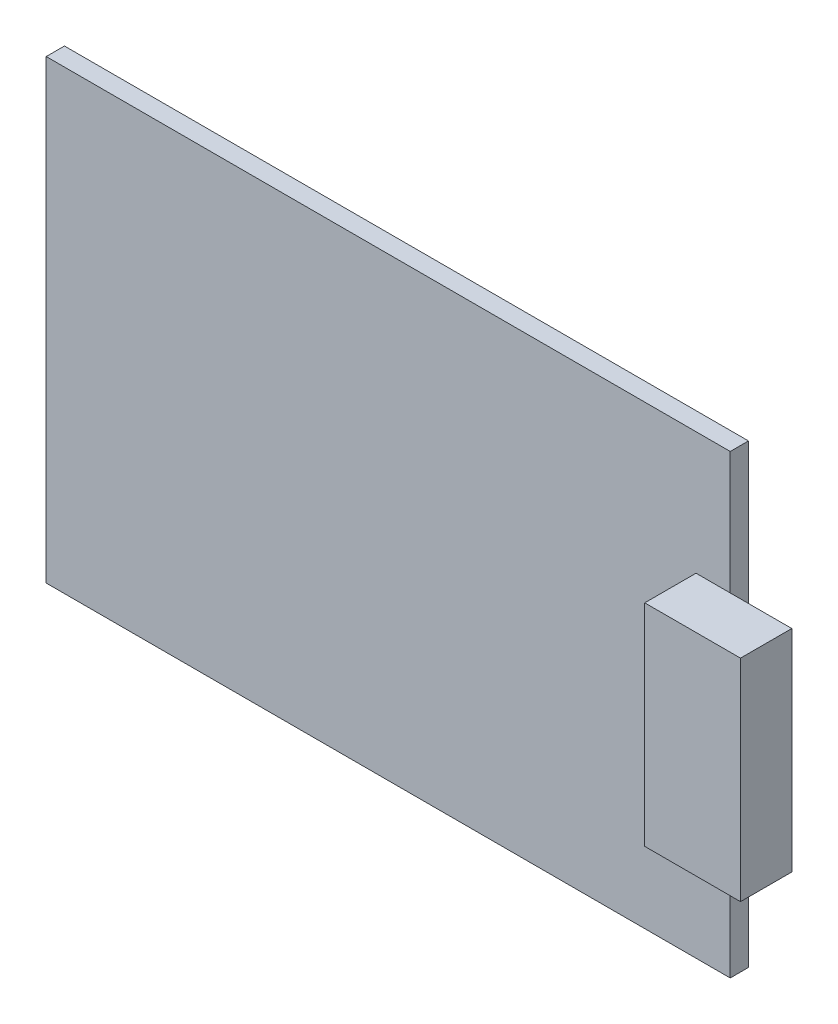
from build123d import *

# Parameters (mm, degrees)
SKETCH1_W                = 40
SKETCH1_H                = 60
BOSS_EXTRUDE1_DEPTH      = 1.6
BOSS_EXTRUDE2_DEPTH      = 5.4
BOSS_EXTRUDE2_DEPTH_BACK = 3
SKETCH2_W                = 18.5
SKETCH2_H                = 4.5


with BuildPart() as part:
    # Sketch1 → Boss-Extrude1 (new body)
    with BuildSketch(Plane(origin=(0, 0, 0), x_dir=(0, 1, 0), z_dir=(0, 0, 1))):
        Rectangle(SKETCH1_W, SKETCH1_H)
    extrude(amount=BOSS_EXTRUDE1_DEPTH)

    # Sketch2 → Boss-Extrude2 (add, two sides: drawn at the far end of the back side and taken through both)
    with BuildSketch(Plane.YZ.offset(30).offset(-BOSS_EXTRUDE2_DEPTH_BACK)):
        with Locations((0, 3.85)):
            Rectangle(SKETCH2_W, SKETCH2_H)
    extrude(amount=BOSS_EXTRUDE2_DEPTH + BOSS_EXTRUDE2_DEPTH_BACK)


solid = part.part
